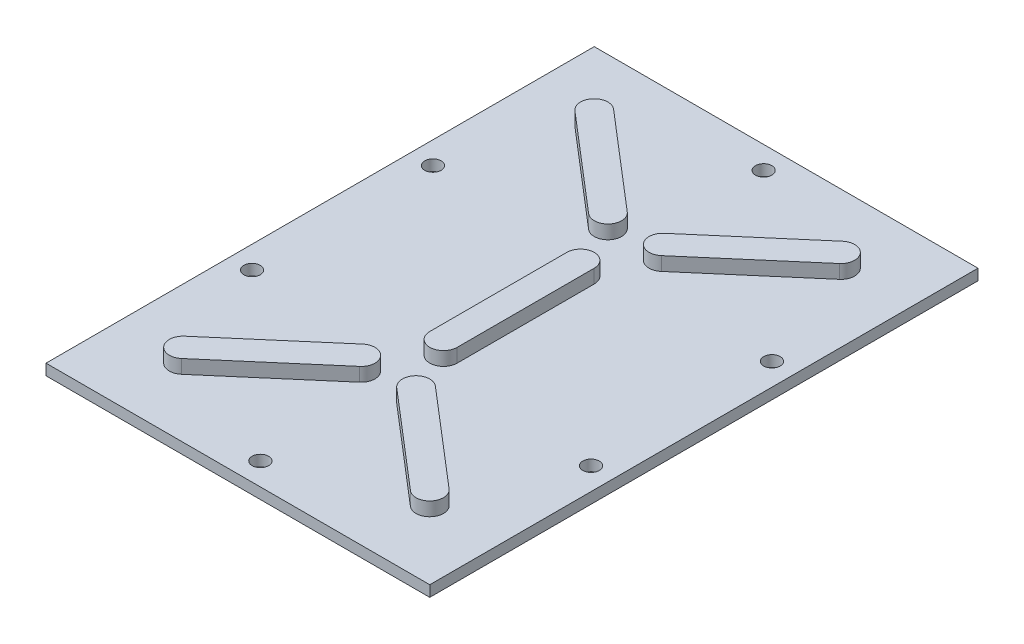
from build123d import *

# Parameters (mm, degrees)
SKETCH2_W           = 140
SKETCH2_H           = 200
BOSS_EXTRUDE1_DEPTH = 4
BOSS_EXTRUDE2_DEPTH = 5
SKETCH4_R           = 3
CUT_EXTRUDE1_DEPTH  = 10


with BuildPart() as part:
    # Sketch2 → Boss-Extrude1 (new body)
    with BuildSketch(Plane(origin=(0, 0, 0), x_dir=(1, 0, 0), z_dir=(0, 1, 0))):
        with Locations((70, 100)):
            Rectangle(SKETCH2_W, SKETCH2_H)
    extrude(amount=-BOSS_EXTRUDE1_DEPTH)

    # Sketch1 → Boss-Extrude2 (add)
    with BuildSketch(Plane(origin=(0, 0, 0), x_dir=(1, 0, 0), z_dir=(0, 1, 0))):
        with BuildLine():
            Line((83.253956867, 58.796283012), (118.253956867, 28.796283012))
            ThreePointArc((118.253956867, 28.796283012), (118.796283012, 21.746043133), (111.746043133, 21.203716988))
            Line((111.746043133, 21.203716988), (76.746043133, 51.203716988))
            ThreePointArc((76.746043133, 51.203716988), (76.203716988, 58.253956867), (83.253956867, 58.796283012))
        make_face()
        with BuildLine():
            Line((65, 75), (65, 125))
            ThreePointArc((65, 125), (70, 130), (75, 125))
            Line((75, 125), (75, 75))
            ThreePointArc((75, 75), (70, 70), (65, 75))
        make_face()
        with BuildLine():
            Line((56.746043133, 58.796283012), (21.746043133, 28.796283012))
            ThreePointArc((21.746043133, 28.796283012), (21.203716988, 21.746043133), (28.253956867, 21.203716988))
            Line((28.253956867, 21.203716988), (63.253956867, 51.203716988))
            ThreePointArc((63.253956867, 51.203716988), (63.796283012, 58.253956867), (56.746043133, 58.796283012))
        make_face()
        with BuildLine():
            Line((56.746043133, 141.203716988), (21.746043133, 171.203716988))
            ThreePointArc((21.746043133, 171.203716988), (21.203716988, 178.253956867), (28.253956867, 178.796283012))
            Line((28.253956867, 178.796283012), (63.253956867, 148.796283012))
            ThreePointArc((63.253956867, 148.796283012), (63.796283012, 141.746043133), (56.746043133, 141.203716988))
        make_face()
        with BuildLine():
            Line((83.253956867, 141.203716988), (118.253956867, 171.203716988))
            ThreePointArc((118.253956867, 171.203716988), (118.796283012, 178.253956867), (111.746043133, 178.796283012))
            Line((111.746043133, 178.796283012), (76.746043133, 148.796283012))
            ThreePointArc((76.746043133, 148.796283012), (76.203716988, 141.746043133), (83.253956867, 141.203716988))
        make_face()
    extrude(amount=BOSS_EXTRUDE2_DEPTH)

    # Sketch4 → Cut-Extrude1 (cut)
    with BuildSketch(Plane(origin=(0, 0, 0), x_dir=(1, 0, 0), z_dir=(0, 1, 0))):
        with Locations(Location((70, 191.8, 0), (0, 0, 270))):
            Circle(SKETCH4_R)
        with Locations(Location((8.166074554, 133, 0), (0, 0, 270))):
            Circle(SKETCH4_R)
        with Locations(Location((70, 8.2, 0), (0, 0, 90))):
            Circle(SKETCH4_R)
        with Locations(Location((8.166074554, 67, 0), (0, 0, 90))):
            Circle(SKETCH4_R)
        with Locations(Location((131.833925446, 67, 0), (0, 0, 270))):
            Circle(SKETCH4_R)
        with Locations(Location((131.833925446, 133, 0), (0, 0, 90))):
            Circle(SKETCH4_R)
    extrude(amount=-CUT_EXTRUDE1_DEPTH, mode=Mode.SUBTRACT)


solid = part.part
